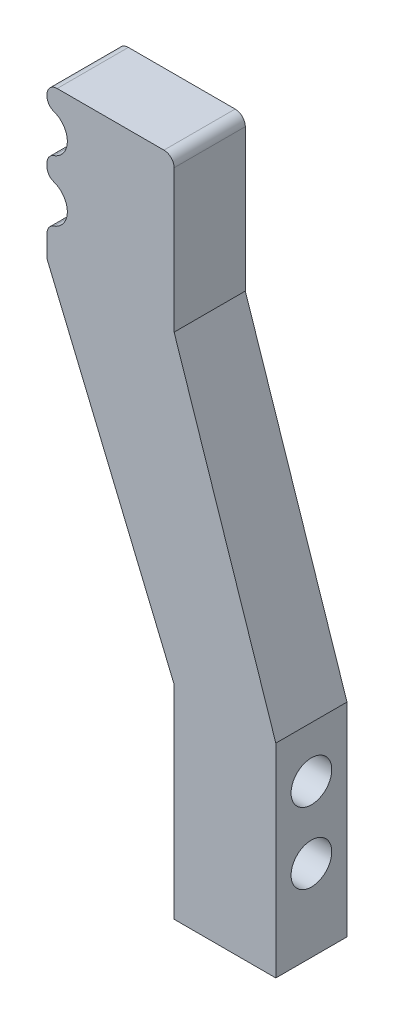
from build123d import *

# Parameters (mm, degrees)
BOSS_EXTRUDE1_DEPTH = 70
SKETCH2_R           = 20
CUT_EXTRUDE1_DEPTH  = 192
CUT_EXTRUDE2_DEPTH  = 192
CUT_EXTRUDE3_DEPTH  = 192


with BuildPart() as part:
    # Sketch1 → Boss-Extrude1 (new body)
    with BuildSketch(Plane.XY):
        with BuildLine():
            Line((-100.084321869, 339.298857864), (-100.084321869, 139.298857864))
            Line((-100.084321869, 139.298857864), (-0.084321869, 139.298857864))
            Line((-0.084321869, 139.298857864), (-0.084321869, 339.298857864))
            Line((-0.084321869, 339.298857864), (-100.084321869, 639.298857864))
            Line((-100.084321869, 639.298857864), (-100.084321869, 779.298857864))
            ThreePointArc((-100.084321869, 779.298857864), (-103.013254057, 786.369925676), (-110.084321869, 789.298857864))
            Line((-110.084321869, 789.298857864), (-215.084321869, 789.298857864))
            ThreePointArc((-215.084321869, 789.298857864), (-222.155389681, 786.369925676), (-225.084321869, 779.298857864))
            Line((-225.084321869, 779.298857864), (-225.084321869, 639.298857864))
            Line((-225.084321869, 639.298857864), (-100.084321869, 339.298857864))
        make_face()
    extrude(amount=BOSS_EXTRUDE1_DEPTH)

    # Sketch2 → Cut-Extrude1 (cut)
    with BuildSketch(Plane(origin=(-0.084321869, 0, 0), x_dir=(0, 0, -1), z_dir=(1, 0, 0))):
        with Locations(Location((-35, 289.298857864, 0), (0, 0, 90))):
            Circle(SKETCH2_R)
        with Locations(Location((-35, 219.298857864, 0), (0, 0, 90))):
            Circle(SKETCH2_R)
    extrude(amount=-CUT_EXTRUDE1_DEPTH, mode=Mode.SUBTRACT)

    # Sketch3 → Cut-Extrude2 (cut)
    with BuildSketch(Plane.XY.offset(70)):
        with BuildLine():
            Line((-225.084321869, 769.298857864), (-225.084321869, 749.298857864))
            Line((-225.084321869, 749.298857864), (-225.084321869, 729.298857864))
            ThreePointArc((-225.084321869, 729.298857864), (-205.084321869, 749.298857864), (-225.084321869, 769.298857864))
        make_face()
        with BuildLine():
            Line((-225.084321869, 689.298857864), (-225.084321869, 669.298857864))
            ThreePointArc((-225.084321869, 669.298857864), (-205.084321869, 689.298857864), (-225.084321869, 709.298857864))
            Line((-225.084321869, 709.298857864), (-225.084321869, 689.298857864))
        make_face()
    extrude(amount=-CUT_EXTRUDE2_DEPTH, mode=Mode.SUBTRACT)

    # Sketch4 → Cut-Extrude3 (cut)
    with BuildSketch(Plane.XY.offset(70)):
        with BuildLine():
            Line((-218.417655203, 730.442677032), (-225.084321869, 729.298857864))
            Line((-225.084321869, 729.298857864), (-225.084321869, 721.014586617))
            ThreePointArc((-225.084321869, 721.014586617), (-223.249287678, 726.788089308), (-218.417655203, 730.442677032))
        make_face()
        with BuildLine():
            Line((-225.084321869, 717.583129111), (-225.084321869, 709.298857864))
            Line((-225.084321869, 709.298857864), (-218.417655203, 708.155038696))
            ThreePointArc((-218.417655203, 708.155038696), (-223.249287678, 711.80962642), (-225.084321869, 717.583129111))
        make_face()
        with BuildLine():
            Line((-218.417655203, 670.442677032), (-225.084321869, 669.298857864))
            Line((-225.084321869, 669.298857864), (-225.084321869, 661.014586617))
            ThreePointArc((-225.084321869, 661.014586617), (-223.249287678, 666.788089308), (-218.417655203, 670.442677032))
        make_face()
        with BuildLine():
            Line((-225.084321869, 777.583129111), (-225.084321869, 769.298857864))
            Line((-225.084321869, 769.298857864), (-218.417655203, 768.155038696))
            ThreePointArc((-218.417655203, 768.155038696), (-223.249287678, 771.80962642), (-225.084321869, 777.583129111))
        make_face()
    extrude(amount=-CUT_EXTRUDE3_DEPTH, mode=Mode.SUBTRACT)


solid = part.part
